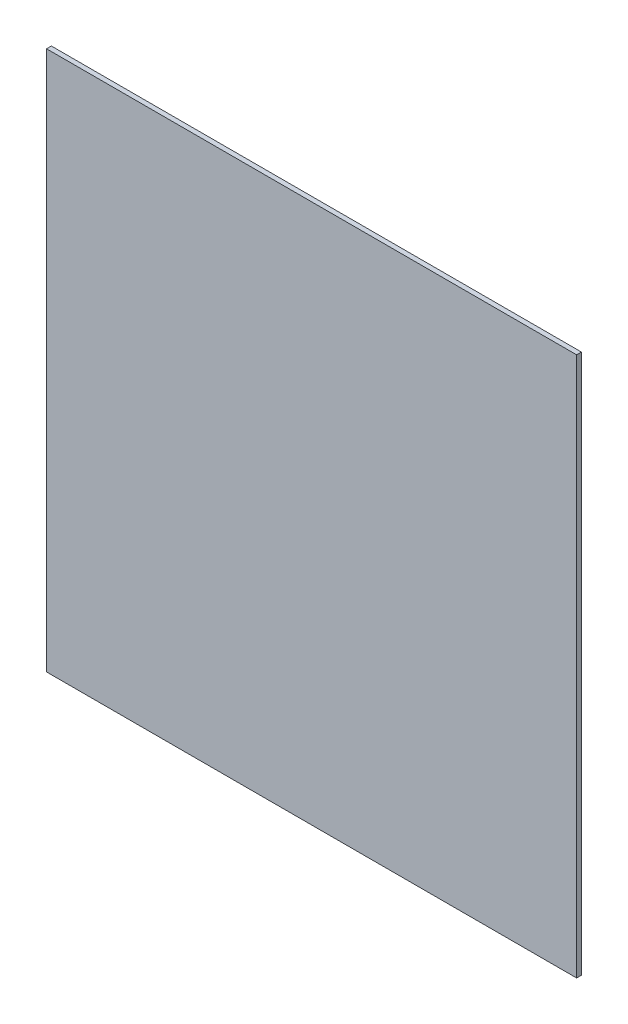
from build123d import *

# Parameters (mm, degrees)
SKETCH1_W           = 5500
SKETCH1_H           = 5600
BOSS_EXTRUDE1_DEPTH = 50
SKETCH2_W           = 375
SKETCH2_H           = 375
CUT_EXTRUDE1_DEPTH  = 10


with BuildPart() as part:
    # Sketch1 → Boss-Extrude1 (new body)
    with BuildSketch(Plane.XY):
        Rectangle(SKETCH1_W, SKETCH1_H)
    extrude(amount=BOSS_EXTRUDE1_DEPTH)

    # Sketch2 → Cut-Extrude1 (cut)
    with BuildSketch(Plane(origin=(0, 0, 0), x_dir=(-1, 0, 0), z_dir=(0, 0, -1))):
        with Locations((-1187.5, 1562.5)):
            Rectangle(SKETCH2_W, SKETCH2_H)
        with Locations((-812.5, 1187.5)):
            Rectangle(SKETCH2_W, SKETCH2_H)
        with Locations((-1187.5, 1187.5)):
            Rectangle(SKETCH2_W, SKETCH2_H)
        with Locations((-812.5, 1562.5)):
            Rectangle(SKETCH2_W, SKETCH2_H)
        with Locations((-1187.5, -1562.5)):
            Rectangle(SKETCH2_W, SKETCH2_H)
        with Locations((-812.5, -1562.5)):
            Rectangle(SKETCH2_W, SKETCH2_H)
        with Locations((-812.5, -1187.5)):
            Rectangle(SKETCH2_W, SKETCH2_H)
        with Locations((-1187.5, -1187.5)):
            Rectangle(SKETCH2_W, SKETCH2_H)
    extrude(amount=-CUT_EXTRUDE1_DEPTH, mode=Mode.SUBTRACT)


solid = part.part
